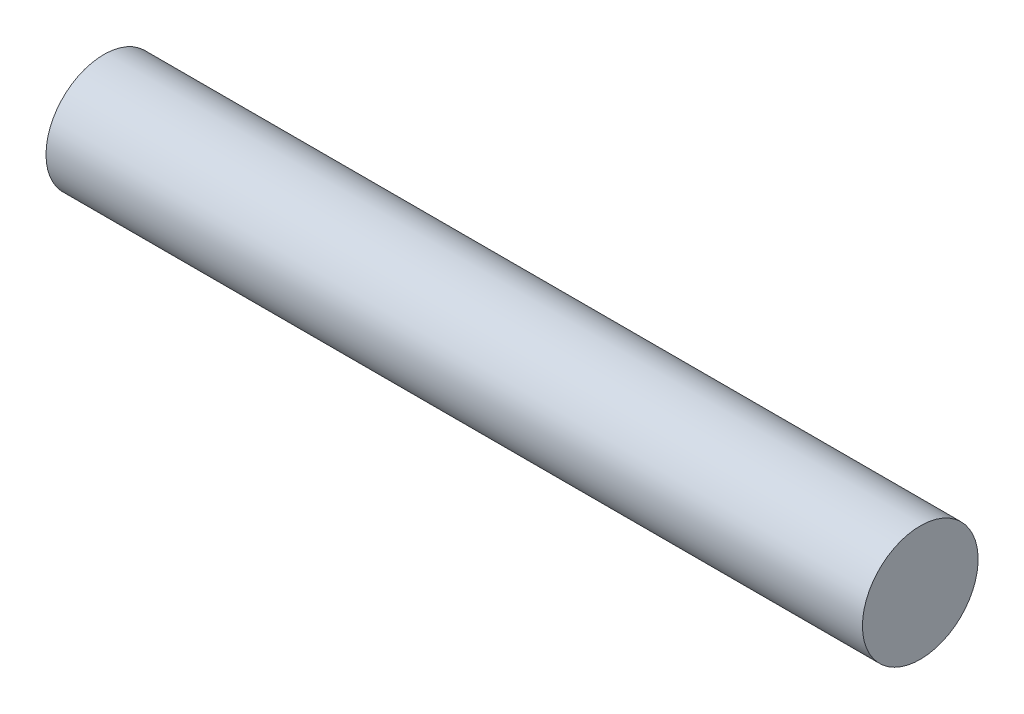
from build123d import *

# Parameters (mm, degrees)
SKETCH2_W = 900
SKETCH2_H = 63.75


with BuildPart() as part:
    # Sketch2 → Revolve1 (revolve)
    with BuildSketch(Plane(origin=(0, 0, 0), x_dir=(1, 0, 0), z_dir=(0, 1, 0))):
        with Locations((450, 31.875)):
            Rectangle(SKETCH2_W, SKETCH2_H)
    revolve(axis=Axis((900, 0, -63.75), (-1, 0, 0)))


solid = part.part
